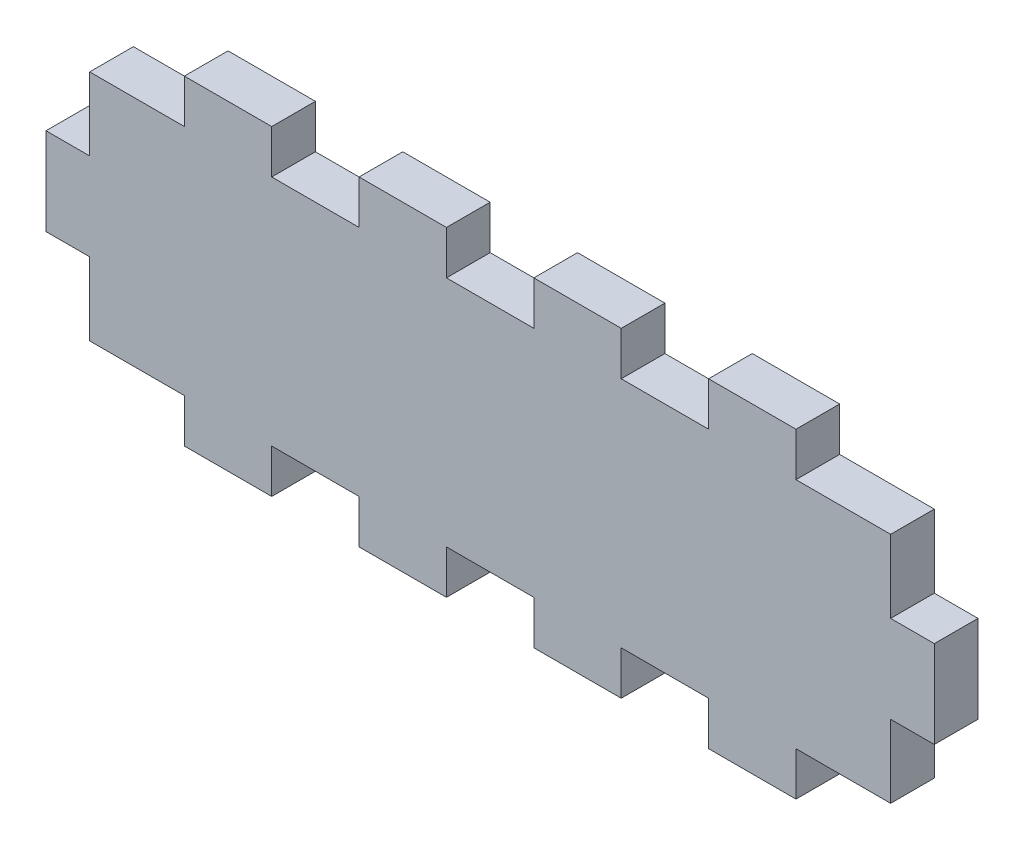
from build123d import *

# Parameters (mm, degrees)
EXTRUDE_1_DEPTH = 3


with BuildPart() as part:
    # Model → 凸台-拉伸1 (new body)
    with BuildSketch(Plane.XY):
        Polygon((92, 47), (92, 42), (89, 42), (89, 36), (92, 36), (92, 31), (98.5, 31), (98.5, 28), (104.5, 28), (104.5, 31), (110.5, 31), (110.5, 28), (116.5, 28), (116.5, 31), (122.5, 31), (122.5, 28), (128.5, 28), (128.5, 31), (134.5, 31), (134.5, 28), (140.5, 28), (140.5, 31), (146.5, 31), (147, 31), (147, 36), (150, 36), (150, 42), (147, 42), (147, 47), (140.5, 47), (140.5, 50), (134.5, 50), (134.5, 47), (128.5, 47), (128.5, 50), (122.5, 50), (122.5, 47), (116.5, 47), (116.5, 50), (110.5, 50), (110.5, 47), (104.5, 47), (104.5, 50), (98.5, 50), (98.5, 47), (92.5, 47), align=None)
    extrude(amount=EXTRUDE_1_DEPTH)


solid = part.part
